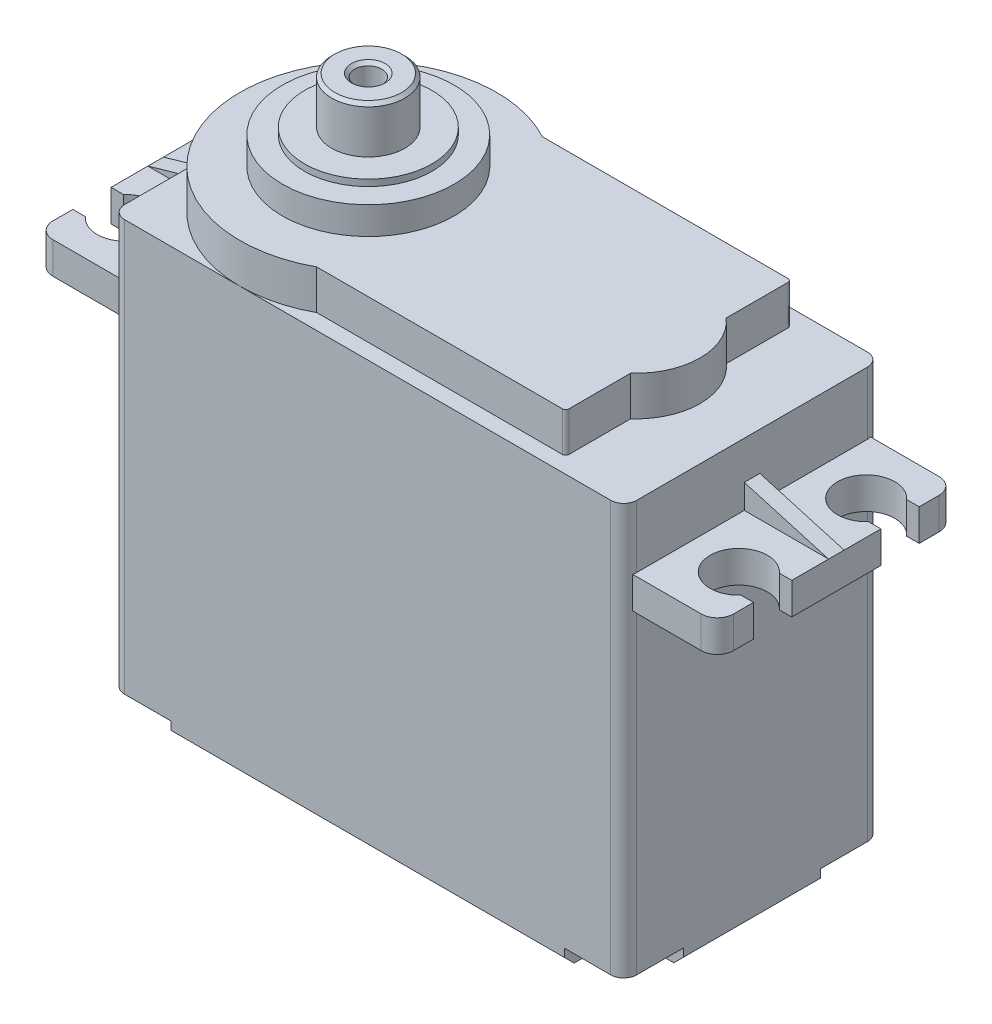
from build123d import *

# Parameters (mm, degrees)
BOSS_EXTRUDE1_DEPTH = 33.6042
CUT_EXTRUDE1_DEPTH  = 1.397
CHAMFER1_SIZE       = 0.762
SKETCH3_W           = 18.6436
SKETCH3_H           = 2.4892
BOSS_EXTRUDE2_DEPTH = 6.604
SKETCH4_W           = 18.6436
SKETCH4_H           = 2.4892
BOSS_EXTRUDE3_DEPTH = 6.604
FILLET1_R           = 1.27
CUT_EXTRUDE2_DEPTH  = 3.048
SKETCH6_W           = 6.604
SKETCH6_H           = 1.2192
BOSS_EXTRUDE4_DEPTH = 1.905
CUT_EXTRUDE3_DEPTH  = 1.905
BOSS_EXTRUDE5_DEPTH = 3.0988
SKETCH9_R           = 6.731
BOSS_EXTRUDE6_DEPTH = 2.159
SKETCH10_R          = 4.9911
BOSS_EXTRUDE7_DEPTH = 0.508
SKETCH11_R          = 2.8702
BOSS_EXTRUDE8_DEPTH = 3.6576
SKETCH12_R          = 1.0668
CUT_EXTRUDE4_DEPTH  = 5.08
CHAMFER2_SIZE       = 0.254
SCALE1_SCALE        = 0.6


with BuildPart() as part:
    # Sketch1 → Boss-Extrude1 (new body)
    with BuildSketch(Plane(origin=(0, 0, 0), x_dir=(1, 0, 0), z_dir=(0, 1, 0))):
        with BuildLine():
            Line((0, 9.0424), (0, -9.0424))
            ThreePointArc((0, -9.0424), (0.29757951, -9.76082049), (1.016, -10.0584))
            Line((1.016, -10.0584), (39.116, -10.0584))
            ThreePointArc((39.116, -10.0584), (39.83442049, -9.76082049), (40.132, -9.0424))
            Line((40.132, -9.0424), (40.132, 9.0424))
            ThreePointArc((40.132, 9.0424), (39.83442049, 9.76082049), (39.116, 10.0584))
            Line((39.116, 10.0584), (1.016, 10.0584))
            ThreePointArc((1.016, 10.0584), (0.29757951, 9.76082049), (0, 9.0424))
        make_face()
    extrude(amount=BOSS_EXTRUDE1_DEPTH)

    # Sketch2 → Cut-Extrude1 (cut)
    with BuildSketch(Plane.XZ):
        with BuildLine():
            Line((4.6482, 10.0584), (4.6482, 7.3533))
            ThreePointArc((4.6482, 7.3533), (4.067919955, 5.952380045), (2.667, 5.3721))
            Line((2.667, 5.3721), (0, 5.3721))
            Line((0, 5.3721), (0, 9.0424))
            ThreePointArc((0, 9.0424), (0.29757951, 9.76082049), (1.016, 10.0584))
            Line((1.016, 10.0584), (4.6482, 10.0584))
        make_face()
        with BuildLine():
            Line((35.4838, 10.0584), (35.4838, 7.3533))
            ThreePointArc((35.4838, 7.3533), (36.064080045, 5.952380045), (37.465, 5.3721))
            Line((37.465, 5.3721), (40.132, 5.3721))
            Line((40.132, 5.3721), (40.132, 9.0424))
            ThreePointArc((40.132, 9.0424), (39.83442049, 9.76082049), (39.116, 10.0584))
            Line((39.116, 10.0584), (35.4838, 10.0584))
        make_face()
        with BuildLine():
            Line((0, -5.3721), (2.667, -5.3721))
            ThreePointArc((2.667, -5.3721), (4.067919955, -5.952380045), (4.6482, -7.3533))
            Line((4.6482, -7.3533), (4.6482, -10.0584))
            Line((4.6482, -10.0584), (1.016, -10.0584))
            ThreePointArc((1.016, -10.0584), (0.29757951, -9.76082049), (0, -9.0424))
            Line((0, -9.0424), (0, -5.3721))
        make_face()
        with BuildLine():
            Line((37.465, -5.3721), (40.132, -5.3721))
            Line((40.132, -5.3721), (40.132, -9.0424))
            ThreePointArc((40.132, -9.0424), (39.83442049, -9.76082049), (39.116, -10.0584))
            Line((39.116, -10.0584), (35.4838, -10.0584))
            Line((35.4838, -10.0584), (35.4838, -7.3533))
            ThreePointArc((35.4838, -7.3533), (36.064080045, -5.952380045), (37.465, -5.3721))
        make_face()
    extrude(amount=-CUT_EXTRUDE1_DEPTH, mode=Mode.SUBTRACT)

    # Chamfer1
    chamfer1_edges = [part.edges().sort_by_distance(p)[0] for p in [
        (20.066, 0, 10.0584),
        (0, 0, 0),
        (40.132, 0, 0),
        (20.066, 0, -10.0584),
    ]]
    chamfer(chamfer1_edges, length=CHAMFER1_SIZE)

    # Sketch3 → Boss-Extrude2 (add, symmetric)
    with BuildSketch(Plane(origin=(40.132, 0, 0), x_dir=(0, 0, -1), z_dir=(1, 0, 0))):
        with Locations((0, 27.4574)):
            Rectangle(SKETCH3_W, SKETCH3_H)
    extrude(amount=BOSS_EXTRUDE2_DEPTH, both=True)

    # Sketch4 → Boss-Extrude3 (add, symmetric)
    with BuildSketch(Plane.ZY):
        with Locations((0, 27.4574)):
            Rectangle(SKETCH4_W, SKETCH4_H)
    extrude(amount=BOSS_EXTRUDE3_DEPTH, both=True)

    # Fillet1
    fillet1_edges = [part.edges().sort_by_distance(p)[0] for p in [
        (46.736, 27.4574, 9.3218),
        (46.736, 27.4574, -9.3218),
        (-6.604, 27.4574, -9.3218),
        (-6.604, 27.4574, 9.3218),
    ]]
    fillet(fillet1_edges, radius=FILLET1_R)

    # Sketch5 → Cut-Extrude2 (cut)
    with BuildSketch(Plane(origin=(0, 28.702, 0), x_dir=(1, 0, 0), z_dir=(0, 1, 0))):
        with BuildLine():
            Line((-6.604, 3.4925), (-5.625185736, 3.4925))
            ThreePointArc((-5.625185736, 3.4925), (-1.7018, 4.9911), (-5.625185736, 6.4897))
            Line((-5.625185736, 6.4897), (-6.604, 6.4897))
            Line((-6.604, 6.4897), (-6.604, 3.4925))
        make_face()
        with BuildLine():
            Line((-6.604, -6.4897), (-5.625185736, -6.4897))
            ThreePointArc((-5.625185736, -6.4897), (-1.7018, -4.9911), (-5.625185736, -3.4925))
            Line((-5.625185736, -3.4925), (-6.604, -3.4925))
            Line((-6.604, -3.4925), (-6.604, -6.4897))
        make_face()
        with BuildLine():
            Line((45.757185736, -6.4897), (46.736, -6.4897))
            Line((46.736, -6.4897), (46.736, -3.4925))
            Line((46.736, -3.4925), (45.757185736, -3.4925))
            ThreePointArc((45.757185736, -3.4925), (41.8338, -4.9911), (45.757185736, -6.4897))
        make_face()
        with BuildLine():
            Line((45.757185736, 3.4925), (46.736, 3.4925))
            Line((46.736, 3.4925), (46.736, 6.4897))
            Line((46.736, 6.4897), (45.757185736, 6.4897))
            ThreePointArc((45.757185736, 6.4897), (41.8338, 4.9911), (45.757185736, 3.4925))
        make_face()
    extrude(amount=-CUT_EXTRUDE2_DEPTH, mode=Mode.SUBTRACT)

    # Sketch6 → Boss-Extrude4 (add)
    with BuildSketch(Plane(origin=(0, 28.702, 0), x_dir=(1, 0, 0), z_dir=(0, 1, 0))):
        with Locations((-3.302, 0)):
            Rectangle(SKETCH6_W, SKETCH6_H)
        with Locations((43.434, 0)):
            Rectangle(SKETCH6_W, SKETCH6_H)
    extrude(amount=BOSS_EXTRUDE4_DEPTH)

    # Sketch7 → Cut-Extrude3 (cut)
    with BuildSketch(Plane.XY.offset(0.6096)):
        Polygon((40.132, 30.607), (46.736, 28.702), (46.736, 30.607), align=None)
        Polygon((0, 30.607), (-6.604, 28.702), (-6.604, 30.607), align=None)
    extrude(amount=-CUT_EXTRUDE3_DEPTH, mode=Mode.SUBTRACT)

    # Sketch8 → Boss-Extrude5 (add)
    with BuildSketch(Plane(origin=(0, 33.6042, 0), x_dir=(1, 0, 0), z_dir=(0, 1, 0))):
        with BuildLine():
            Line((14.8583952, -8.8392), (34.1122, -8.8392))
            ThreePointArc((34.1122, -8.8392), (34.291805122, -8.764805122), (34.3662, -8.5852))
            Line((34.3662, -8.5852), (34.3662, -3.741254719))
            ThreePointArc((34.3662, -3.741254719), (36.053651663, 0), (34.3662, 3.741254719))
            Line((34.3662, 3.741254719), (34.3662, 8.5852))
            ThreePointArc((34.3662, 8.5852), (34.291805122, 8.764805122), (34.1122, 8.8392))
            Line((34.1122, 8.8392), (14.8583952, 8.8392))
            ThreePointArc((14.8583952, 8.8392), (0, 0), (14.8583952, -8.8392))
        make_face()
    extrude(amount=BOSS_EXTRUDE5_DEPTH)

    # Sketch9 → Boss-Extrude6 (add)
    with BuildSketch(Plane(origin=(0, 36.703, 0), x_dir=(1, 0, 0), z_dir=(0, 1, 0))):
        with Locations(Location((10.0584, 0, 0), (0, 0, 270))):
            Circle(SKETCH9_R)
    extrude(amount=BOSS_EXTRUDE6_DEPTH)

    # Sketch10 → Boss-Extrude7 (add)
    with BuildSketch(Plane(origin=(0, 38.862, 0), x_dir=(1, 0, 0), z_dir=(0, 1, 0))):
        with Locations(Location((10.0584, 0, 0), (0, 0, 270))):
            Circle(SKETCH10_R)
    extrude(amount=BOSS_EXTRUDE7_DEPTH)

    # Sketch11 → Boss-Extrude8 (add)
    with BuildSketch(Plane(origin=(0, 39.37, 0), x_dir=(1, 0, 0), z_dir=(0, 1, 0))):
        with Locations(Location((10.0584, 0, 0), (0, 0, 270))):
            Circle(SKETCH11_R)
    extrude(amount=BOSS_EXTRUDE8_DEPTH)

    # Sketch12 → Cut-Extrude4 (cut)
    with BuildSketch(Plane(origin=(0, 43.0276, 0), x_dir=(1, 0, 0), z_dir=(0, 1, 0))):
        with Locations(Location((10.0584, 0, 0), (0, 0, 270))):
            Circle(SKETCH12_R)
    extrude(amount=-CUT_EXTRUDE4_DEPTH, mode=Mode.SUBTRACT)

    # Chamfer2
    chamfer2_edges = [part.edges().sort_by_distance(p)[0] for p in [
        (10.0584, 43.0276, -2.8702),
        (10.0584, 43.0276, -1.0668),
    ]]
    chamfer(chamfer2_edges, length=CHAMFER2_SIZE)


with BuildPart() as part_1:
    # Scale1: scaled about (19.790017038, 18.508512474, 0)
    add(part.part.scale(SCALE1_SCALE).moved(Location((7.916006815, 7.40340499, 0))))


solid = part_1.part
